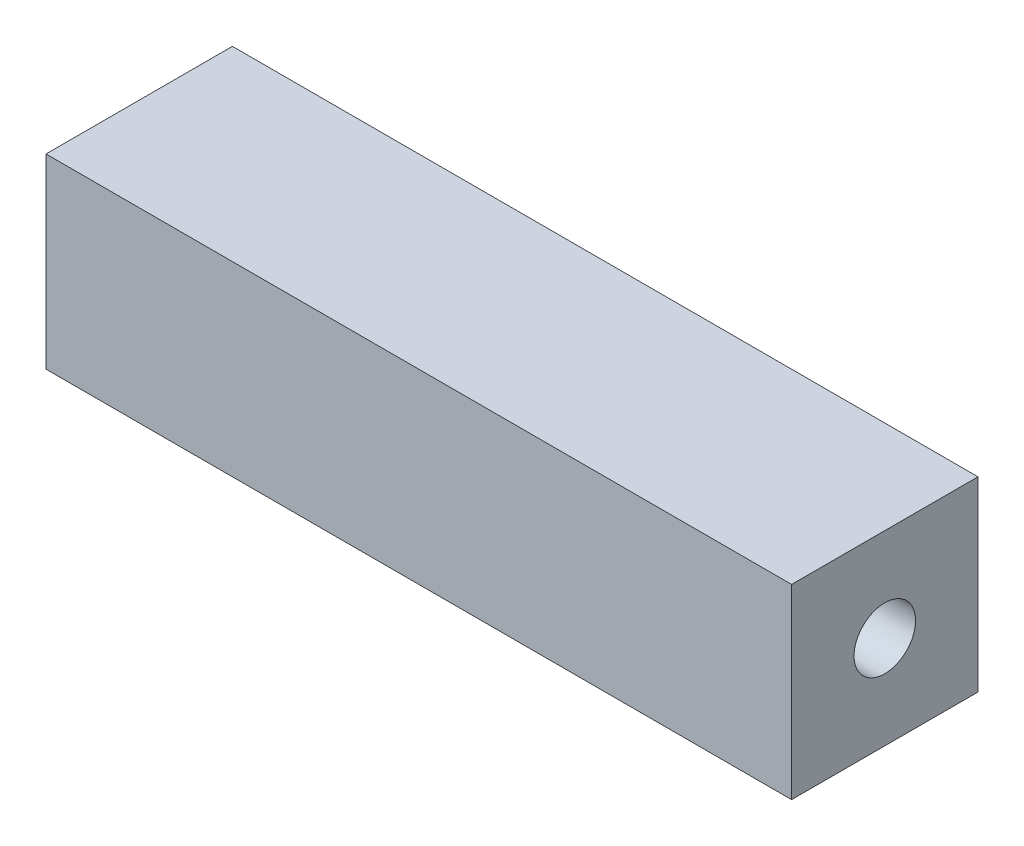
from build123d import *

# Parameters (mm, degrees)
SKETCH1_W                           = 40
SKETCH1_H                           = 10
BOSS_EXTRUDE1_DEPTH                 = 10
M4X0_7_TAPPED_HOLE1_D               = 3.3
M4X0_7_TAPPED_HOLE1_DEPTH           = 16
M4X0_7_TAPPED_HOLE1_TIP             = 0.991420021
M4X0_7_TAPPED_HOLE1_ON_FACE_2_D     = 3.3
M4X0_7_TAPPED_HOLE1_ON_FACE_2_DEPTH = 16
M4X0_7_TAPPED_HOLE1_ON_FACE_2_TIP   = 0.991420021


with BuildPart() as part:
    # Sketch1 → Boss-Extrude1 (new body)
    with BuildSketch(Plane(origin=(0, 0, 0), x_dir=(1, 0, 0), z_dir=(0, 1, 0))):
        Rectangle(SKETCH1_W, SKETCH1_H)
    extrude(amount=BOSS_EXTRUDE1_DEPTH)

    # M4x0.7 Tapped Hole1
    with Locations(Plane(origin=(-20, 5, 0), x_dir=(0, 0, -1), z_dir=(-1, 0, 0))):
        with Locations((0, 0)):
            Hole(M4X0_7_TAPPED_HOLE1_D / 2, depth=M4X0_7_TAPPED_HOLE1_DEPTH)
            with Locations((0, 0, -(M4X0_7_TAPPED_HOLE1_DEPTH + M4X0_7_TAPPED_HOLE1_TIP / 2))):  # 118° drill point
                Cone(0, M4X0_7_TAPPED_HOLE1_D / 2, M4X0_7_TAPPED_HOLE1_TIP, mode=Mode.SUBTRACT)

    # M4x0.7 Tapped Hole1 on face 2
    with Locations(Plane(origin=(20, 5, 0), x_dir=(0, 0, 1), z_dir=(1, 0, 0))):
        with Locations((0, 0)):
            Hole(M4X0_7_TAPPED_HOLE1_ON_FACE_2_D / 2, depth=M4X0_7_TAPPED_HOLE1_ON_FACE_2_DEPTH)
            with Locations((0, 0, -(M4X0_7_TAPPED_HOLE1_ON_FACE_2_DEPTH + M4X0_7_TAPPED_HOLE1_ON_FACE_2_TIP / 2))):  # 118° drill point
                Cone(0, M4X0_7_TAPPED_HOLE1_ON_FACE_2_D / 2, M4X0_7_TAPPED_HOLE1_ON_FACE_2_TIP, mode=Mode.SUBTRACT)


solid = part.part
